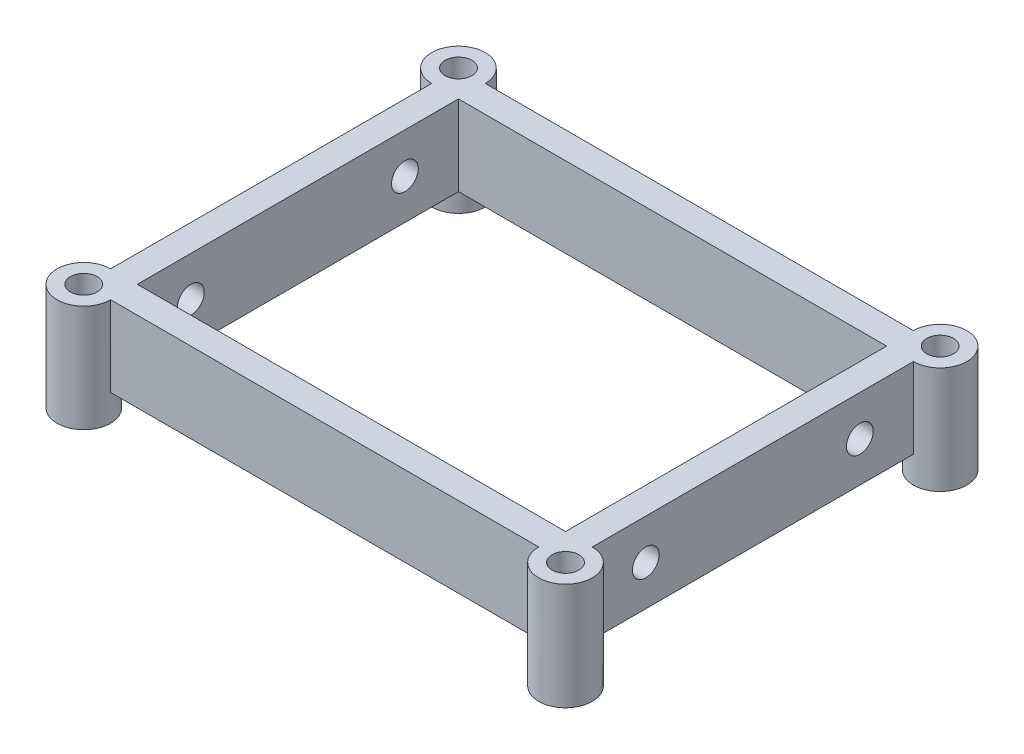
from build123d import *

# Parameters (mm, degrees)
SKETCH_1_W          = 90
SKETCH_1_H          = 70
SKETCH_1_W_2        = 80
SKETCH_1_H_2        = 60
EXTRUDE_1_DEPTH     = 15
SKETCH_2_R          = 2.5
CUT_EXTRUDE_1_DEPTH = 98.724101428
SKETCH_3_R          = 5
EXTRUDE_3_DEPTH     = 15
SKETCH_5_R          = 2.5
CUT_EXTRUDE_2_DEPTH = 15
SKETCH_13_R         = 5
SKETCH_13_R_2       = 2.5
EXTRUDE_4_DEPTH     = 5


with BuildPart() as part:
    # 草图1 → 凸台-拉伸1 (new body)
    with BuildSketch(Plane(origin=(0, 0, 0), x_dir=(1, 0, 0), z_dir=(0, 1, 0))):
        with Locations((40, 0)):
            Rectangle(SKETCH_1_W, SKETCH_1_H)
        with Locations((40, 0)):
            Rectangle(SKETCH_1_W_2, SKETCH_1_H_2, mode=Mode.SUBTRACT)
    extrude(amount=EXTRUDE_1_DEPTH)

    # 草图2 → 切除-拉伸1 (cut, through all)
    with BuildSketch(Plane(origin=(85, 0, 0), x_dir=(0, 0, -1), z_dir=(1, 0, 0))):
        with Locations((20, 7.5)):
            Circle(SKETCH_2_R)
        with Locations(Location((-20, 7.5, 0), (0, 0, 180))):
            Circle(SKETCH_2_R)
    extrude(amount=-CUT_EXTRUDE_1_DEPTH, mode=Mode.SUBTRACT)

    # 草图3 → 凸台-拉伸3 (add)
    with BuildSketch(Plane(origin=(0, 15, 0), x_dir=(1, 0, 0), z_dir=(0, 1, 0))):
        with Locations((85, 35)):
            Circle(SKETCH_3_R)
        with Locations((85, -35)):
            Circle(SKETCH_3_R)
        with Locations((-5, -35)):
            Circle(SKETCH_3_R)
        with Locations((-5, 35)):
            Circle(SKETCH_3_R)
    extrude(amount=-EXTRUDE_3_DEPTH)

    # 草图5 → 切除-拉伸2 (cut)
    with BuildSketch(Plane(origin=(0, 15, 0), x_dir=(1, 0, 0), z_dir=(0, 1, 0))):
        with Locations(Location((-5, -35, 0), (0, 0, 270))):
            Circle(SKETCH_5_R)
        with Locations(Location((-5, 35, 0), (0, 0, 270))):
            Circle(SKETCH_5_R)
        with Locations(Location((85, 35, 0), (0, 0, 270))):
            Circle(SKETCH_5_R)
        with Locations(Location((85, -35, 0), (0, 0, 270))):
            Circle(SKETCH_5_R)
    extrude(amount=-CUT_EXTRUDE_2_DEPTH, mode=Mode.SUBTRACT)

    # 草图13 → 凸台-拉伸4 (add)
    # profile 1 of 4: a face of its own
    with BuildSketch(Plane.XZ):
        with Locations(Location((85, -35, 0), (0, 0, 90))):
            Circle(SKETCH_13_R)
        with Locations(Location((85, -35, 0), (0, 0, 90))):
            Circle(SKETCH_13_R_2, mode=Mode.SUBTRACT)
    # profile 2 of 4: a face of its own
    with BuildSketch(Plane.XZ):
        with Locations(Location((85, 35, 0), (0, 0, 270))):
            Circle(SKETCH_13_R)
        with Locations(Location((85, 35, 0), (0, 0, 90))):
            Circle(SKETCH_13_R_2, mode=Mode.SUBTRACT)
    # profile 3 of 4: a face of its own
    with BuildSketch(Plane.XZ):
        with Locations(Location((-5, 35, 0), (0, 0, 90))):
            Circle(SKETCH_13_R)
        with Locations(Location((-5, 35, 0), (0, 0, 90))):
            Circle(SKETCH_13_R_2, mode=Mode.SUBTRACT)
    # profile 4 of 4: a face of its own
    with BuildSketch(Plane.XZ):
        with Locations(Location((-5, -35, 0), (0, 0, 90))):
            Circle(SKETCH_13_R)
        with Locations(Location((-5, -35, 0), (0, 0, 90))):
            Circle(SKETCH_13_R_2, mode=Mode.SUBTRACT)
    extrude(amount=EXTRUDE_4_DEPTH)


solid = part.part
